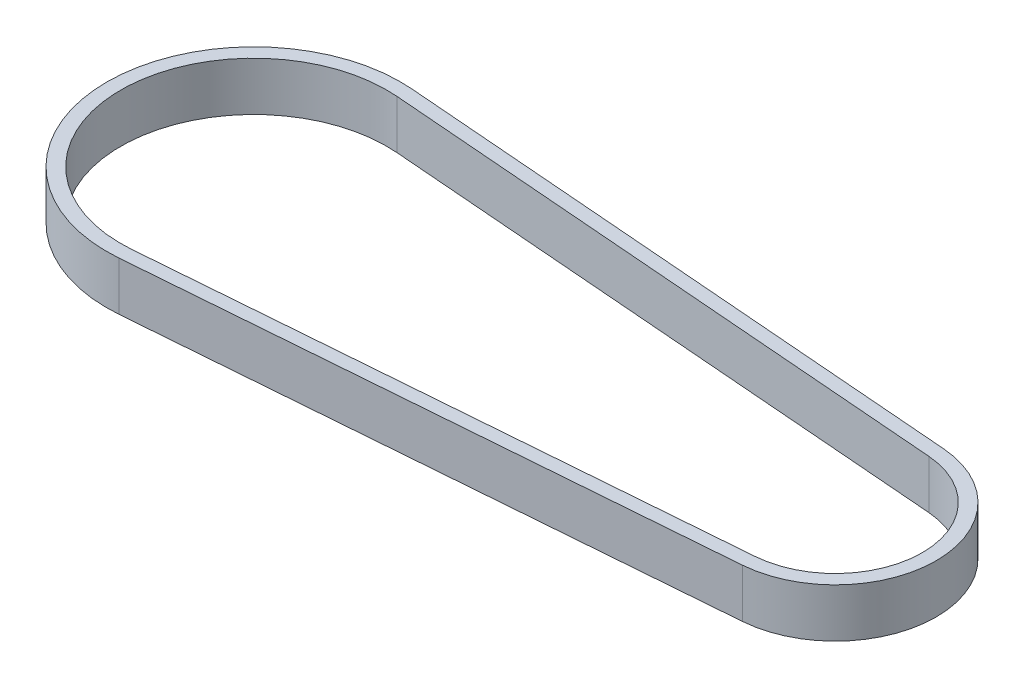
from build123d import *

# Parameters (mm, degrees)
EXTRUDE_1_DEPTH = 7


with BuildPart() as part:
    # 草图1 → 凸台-拉伸1 (new body)
    with BuildSketch(Plane(origin=(0, 0, 0), x_dir=(1, 0, 0), z_dir=(0, 1, 0))):
        with BuildLine():
            Line((1.666525216, 21.029068422), (84.625513896, 14.454680831))
            ThreePointArc((84.625513896, 14.454680831), (97.98, 0), (84.625513896, -14.454680831))
            Line((84.625513896, -14.454680831), (1.666525216, -21.029068422))
            ThreePointArc((1.666525216, -21.029068422), (-21.095, 0), (1.666525216, 21.029068422))
        make_face()
        with BuildLine():
            ThreePointArc((84.467511979, -12.460931751), (95.98, 0), (84.467511979, 12.460931751))
            Line((84.467511979, 12.460931751), (1.508523299, 19.035319342))
            ThreePointArc((1.508523299, 19.035319342), (-19.095, 0), (1.508523299, -19.035319342))
            Line((1.508523299, -19.035319342), (84.467511979, -12.460931751))
        make_face(mode=Mode.SUBTRACT)
    extrude(amount=EXTRUDE_1_DEPTH)


solid = part.part
